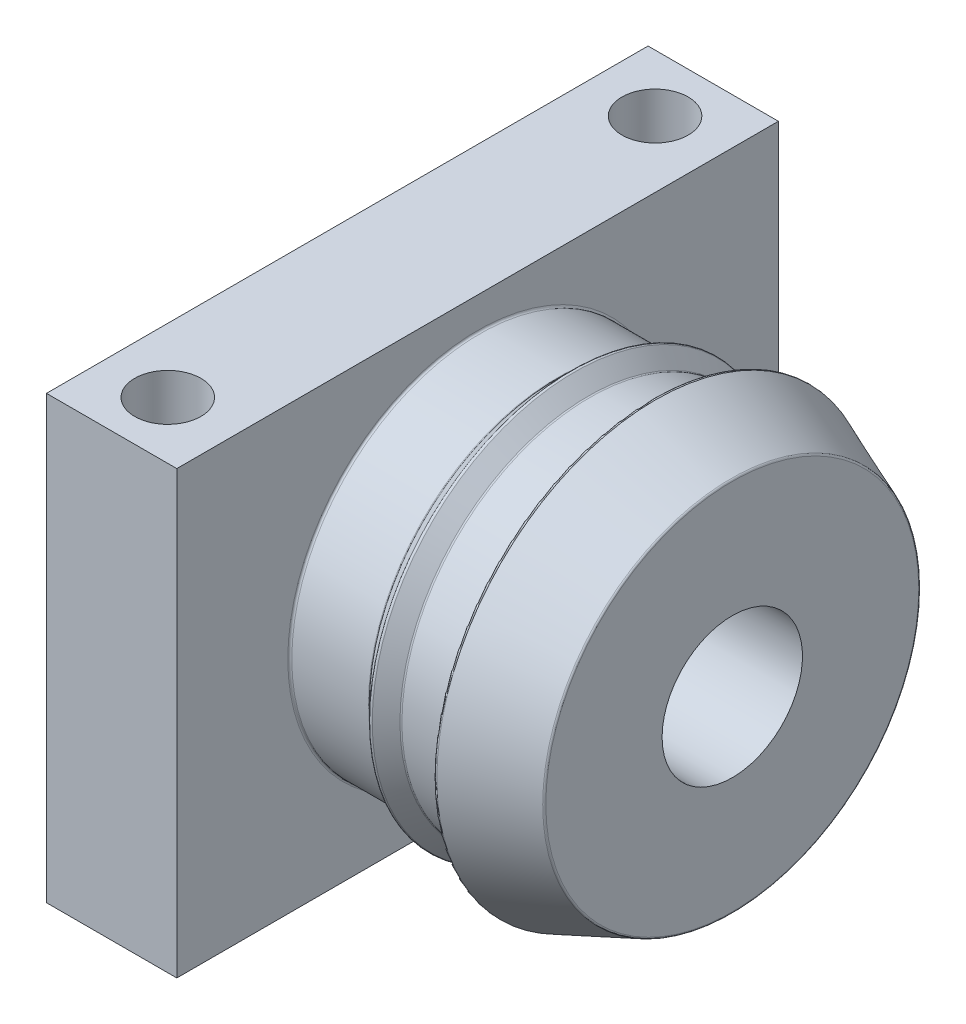
from build123d import *

# Parameters (mm, degrees)
SKETCH2_W               = 30
SKETCH2_H               = 22
SKETCH2_R               = 3.5
BOSS_EXTRUDE1_DEPTH     = 1.5
BOSS_EXTRUDE2_DEPTH     = 2
SKETCH2_4_R             = 0.9
BOSS_EXTRUDE3_DEPTH     = 5
SKETCH2_5_R             = 3.5
SKETCH2_5_W             = 2.46
SKETCH2_5_H             = 4.35
CUT_EXTRUDE1_DEPTH      = 23.523099254
BOSS_EXTRUDE4_START     = 1.5
SKETCH2_6_W             = 30
SKETCH2_6_H             = 22
SKETCH2_6_W_2           = 18.58
SKETCH2_6_H_2           = 14.05
BOSS_EXTRUDE4_DEPTH     = 5
FILLET1_R               = 0.1
FILLET4_R               = 0.2
FILLET5_R               = 0.2
SKETCH4_R               = 1.65
CUT_EXTRUDE2_DEPTH      = 29.352953991
CUT_EXTRUDE3_DEPTH      = 7
CUT_EXTRUDE3_DEPTH_BACK = 7
CUT_SWEEP1_PROFILE_R    = 0.6
FILLET6_R               = 0.2


with BuildPart() as part:
    # Sketch1 → Revolve1 (revolve)
    with BuildSketch(Plane(origin=(0, 0, 0), x_dir=(1, 0, 0), z_dir=(0, 1, 0))):
        Polygon((0, 0), (-12.7, 0), (-12.7, 9.365), (-8.73, 9.365), (-7.94, 10.155), (-7.15, 9.365), (-3.97, 9.365), (-3.97, 10.955), (0, 9.365), align=None)
    revolve(axis=Axis((0, 0, 0), (-1, 0, 0)))

    # Sketch2 → Boss-Extrude1 (add)
    with BuildSketch(Plane.ZY.offset(12.7)):
        Rectangle(SKETCH2_W, SKETCH2_H)
        Circle(SKETCH2_R, mode=Mode.SUBTRACT)
    extrude(amount=BOSS_EXTRUDE1_DEPTH)

    # Sketch2<3> → Boss-Extrude2 (add)
    with BuildSketch(Plane.ZY.offset(12.7)):
        with BuildLine():
            ThreePointArc((-8.143254878, -4.625), (-7.532295819, -5.564866997), (-6.813413242, -6.425))
            Line((-6.813413242, -6.425), (6.813413242, -6.425))
            ThreePointArc((6.813413242, -6.425), (7.532295819, -5.564866997), (8.143254878, -4.625))
            Line((8.143254878, -4.625), (-8.143254878, -4.625))
        make_face()
        with BuildLine():
            ThreePointArc((8.143254878, -4.625), (7.532295819, -5.564866997), (6.813413242, -6.425))
            Line((6.813413242, -6.425), (8.59, -6.425))
            Line((8.59, -6.425), (8.59, -4.625))
            Line((8.59, -4.625), (8.143254878, -4.625))
        make_face()
        with BuildLine():
            Line((-8.59, -4.625), (-8.59, -6.425))
            Line((-8.59, -6.425), (-6.813413242, -6.425))
            ThreePointArc((-6.813413242, -6.425), (-7.532295819, -5.564866997), (-8.143254878, -4.625))
            Line((-8.143254878, -4.625), (-8.59, -4.625))
        make_face()
    extrude(amount=BOSS_EXTRUDE2_DEPTH)

    # Sketch2<4> → Boss-Extrude3 (add)
    with BuildSketch(Plane.ZY.offset(12.7)):
        with Locations((6.19, 3.935)):
            Circle(SKETCH2_4_R)
        with Locations((-6.19, 3.935)):
            Circle(SKETCH2_4_R)
    extrude(amount=BOSS_EXTRUDE3_DEPTH)

    # Sketch2<5> → Cut-Extrude1 (cut, through all)
    # profile 1 of 2: a face of its own
    with BuildSketch(Plane.ZY.offset(12.7)):
        Circle(SKETCH2_5_R)
        with Locations((-0.31, 0.56)):
            Rectangle(SKETCH2_5_W, SKETCH2_5_H, mode=Mode.SUBTRACT)
    # profile 2 of 2: a face of its own
    with BuildSketch(Plane.ZY.offset(12.7)):
        with Locations((-0.31, 0.56)):
            Rectangle(SKETCH2_5_W, SKETCH2_5_H)
    extrude(amount=-CUT_EXTRUDE1_DEPTH, mode=Mode.SUBTRACT)

    # Sketch2<6> → Boss-Extrude4 (add)
    with BuildSketch(Plane.ZY.offset(12.7).offset(BOSS_EXTRUDE4_START)):
        Rectangle(SKETCH2_6_W, SKETCH2_6_H)
        with Locations((0, -0.4)):
            Rectangle(SKETCH2_6_W_2, SKETCH2_6_H_2, mode=Mode.SUBTRACT)
    extrude(amount=BOSS_EXTRUDE4_DEPTH)

    # Fillet1
    fillet1_edges = [part.edges().sort_by_distance(p)[0] for p in [
        (-3.97, 0, 9.365),
        (-3.97, 0, 10.955),
        (0, 0, 9.365),
        (-12.7, 0, 9.365),
        (-8.73, 0, 9.365),
        (-7.94, 0, 10.155),
        (-7.15, 0, 9.365),
    ]]
    fillet(fillet1_edges, radius=FILLET1_R)

    # Fillet4
    fillet4_edges = [part.edges().sort_by_distance(p)[0] for p in [
        (-17.7, 3.935, 5.29),
        (-17.7, 3.935, -7.09),
    ]]
    fillet(fillet4_edges, radius=FILLET4_R)

    # Fillet5
    fillet5_edges = [part.edges().sort_by_distance(p)[0] for p in [
        (-14.7, -4.625, 0),
        (-14.7, -5.525, -8.59),
        (-14.7, -6.425, 0),
        (-14.7, -5.525, 8.59),
    ]]
    fillet(fillet5_edges, radius=FILLET5_R)

    # Sketch4 → Cut-Extrude2 (cut, symmetric)
    with BuildSketch(Plane(origin=(0, 3.5, 0), x_dir=(-1, 0, 0), z_dir=(0, -1, 0))):
        with Locations(Location((16, 12.15, 0), (0, 0, 90))):
            Circle(SKETCH4_R)
    cut_extrude2 = extrude(amount=CUT_EXTRUDE2_DEPTH, both=True, mode=Mode.SUBTRACT)

    # Mirror1: Cut-Extrude2 across plane
    add(cut_extrude2.mirror(Plane(origin=(0, 0, 0), x_dir=(1, 0, 0), z_dir=(0, 0, -1))), mode=Mode.SUBTRACT)

    # Sketch5 → Cut-Extrude3 (cut, two sides: drawn at the far end of the back side and taken through both)
    with BuildSketch(Plane(origin=(0, 0, 0), x_dir=(-1, 0, 0), z_dir=(0, 0, -1)).offset(-CUT_EXTRUDE3_DEPTH_BACK)):
        Polygon((17.9, -11), (17.9, -9.834230855), (15.4, -11), align=None)
    extrude(amount=CUT_EXTRUDE3_DEPTH + CUT_EXTRUDE3_DEPTH_BACK, mode=Mode.SUBTRACT)

    # Cut-Sweep1: sweep along a path in Sketch6
    with BuildLine(Plane.ZY.offset(19.2)) as cut_sweep1_path:
        Line((-10.79, 7.625), (10.29, 7.625))
        Line((10.29, 7.625), (10.29, -8.425))
        Line((10.29, -8.425), (-10.79, -8.425))
        Line((-10.79, -8.425), (-10.79, 7.625))
    # Cut-Sweep1 profile (on start of the path) → Cut-Sweep1 (sweep, cut)
    with BuildSketch(Plane(origin=(-19.2, 7.625, -10.79), x_dir=(1, 0, 0), z_dir=(0, 0, 1))):
        Circle(CUT_SWEEP1_PROFILE_R)
    sweep(path=cut_sweep1_path.line, transition=Transition.RIGHT, mode=Mode.SUBTRACT)

    # Fillet6
    fillet6_edges = [part.edges().sort_by_distance(p)[0] for p in [
        (-14.2, 3.935, 5.29),
        (-14.2, 3.935, -7.09),
    ]]
    fillet(fillet6_edges, radius=FILLET6_R)


solid = part.part
